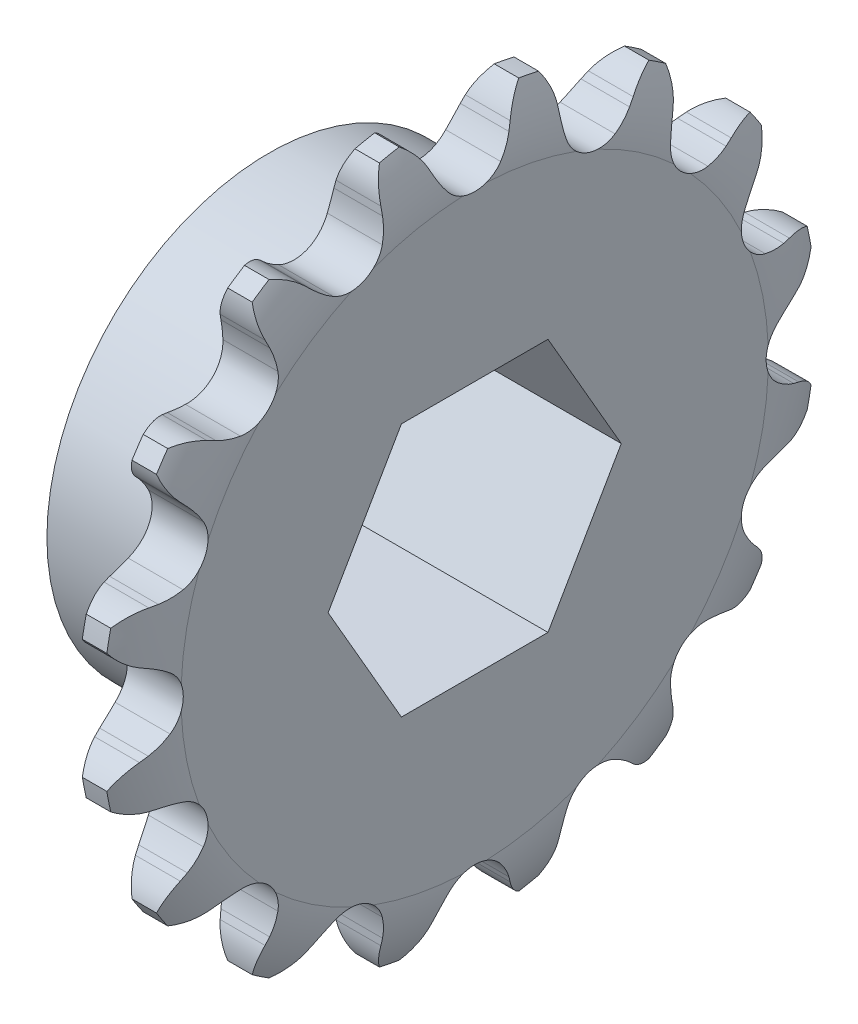
from build123d import *

# Parameters (mm, degrees)
TOOTHCUT_DEPTH     = 26.422180322
TEETHCUTS_COUNT    = 16
TEETHCUTS_ANGLE    = 337.5
HUBNEAONESKE_R     = 11.1125
HUBNEARONE_DEPTH   = 7.4867008
BORSKE_R           = 6.35
BORE_DEPTH         = 10.2870508
CUT_EXTRUDE1_DEPTH = 27.951739208


with BuildPart() as part:
    # BasProSke → Base-Revolve (revolve)
    with BuildSketch(Plane(origin=(0, 0, 0), x_dir=(1, 0, 0), z_dir=(0, 1, 0)), mode=Mode.PRIVATE) as base_revolve_sk:
        with BuildLine():
            Line((0, 0), (0, 14.691802906))
            ThreePointArc((0, 14.691802906), (0.199787117, 16.327393301), (0.7874, 17.866802906))
            Line((0.7874, 17.866802906), (2.01295, 17.866802906))
            ThreePointArc((2.01295, 17.866802906), (2.600562883, 16.327393301), (2.80035, 14.691802906))
            Line((2.80035, 14.691802906), (2.80035, 0))
            Line((2.80035, 0), (0, 0))
        make_face()
    revolve(base_revolve_sk.sketch.rotate(Axis((-10, 0, 0), (1, 0, 0)), 180), axis=Axis((-10, 0, 0), (1, 0, 0)))

    # TooCutSke → ToothCut (cut, through all)
    with BuildSketch(Plane(origin=(0, 0, 0), x_dir=(0, 0, -1), z_dir=(1, 0, 0))):
        with BuildLine():
            Line((1.895951627, 16.145861936), (2.051408679, 16.490963794))
            ThreePointArc((2.051408679, 16.490963794), (3.056004648, 17.659429898), (4.533974194, 18.095471314))
            ThreePointArc((4.533974194, 18.095471314), (0, 18.654838624), (-4.533974194, 18.095471314))
            ThreePointArc((-4.533974194, 18.095471314), (-3.056004648, 17.659429898), (-2.051408679, 16.490963794))
            Line((-2.051408679, 16.490963794), (-1.895951627, 16.145861936))
            ThreePointArc((-1.895951627, 16.145861936), (-1.639424454, 15.660854796), (-1.323740827, 15.212098776))
            ThreePointArc((-1.323740827, 15.212098776), (0, 14.577158112), (1.323740827, 15.212098776))
            ThreePointArc((1.323740827, 15.212098776), (1.639424454, 15.660854796), (1.895951627, 16.145861936))
        make_face()
    toothcut = extrude(amount=TOOTHCUT_DEPTH, mode=Mode.SUBTRACT)

    # TeethCuts: ToothCut ×16 about axis
    teethcuts_axis = Axis((-10, 0, 0), (1, 0, 0))
    for i in range(1, TEETHCUTS_COUNT):
        add(toothcut.rotate(teethcuts_axis, i * TEETHCUTS_ANGLE / (TEETHCUTS_COUNT - 1)), mode=Mode.SUBTRACT)

    # HubNeaOneSke → HubNearOne (add)
    with BuildSketch(Plane.ZY):
        with Locations(Location((0, 0, 0), (0, 0, 180))):
            Circle(HUBNEAONESKE_R)
    extrude(amount=HUBNEARONE_DEPTH)

    # BorSke → Bore (cut, symmetric)
    with BuildSketch(Plane(origin=(0, 0, 0), x_dir=(0, 0, -1), z_dir=(1, 0, 0))):
        with Locations(Location((0, 0, 0), (0, 0, 180))):
            Circle(BORSKE_R)
    extrude(amount=BORE_DEPTH, both=True, mode=Mode.SUBTRACT)

    # Sketch1 → Cut-Extrude1 (cut, through all)
    with BuildSketch(Plane(origin=(2.80035, 0, 0), x_dir=(0, 0, -1), z_dir=(1, 0, 0))):
        Polygon((7.332348419, 0), (3.666174209, 6.35), (-3.666174209, 6.35), (-7.332348419, 0), (-3.666174209, -6.35), (3.666174209, -6.35), align=None)
    extrude(amount=-CUT_EXTRUDE1_DEPTH, mode=Mode.SUBTRACT)


solid = part.part
